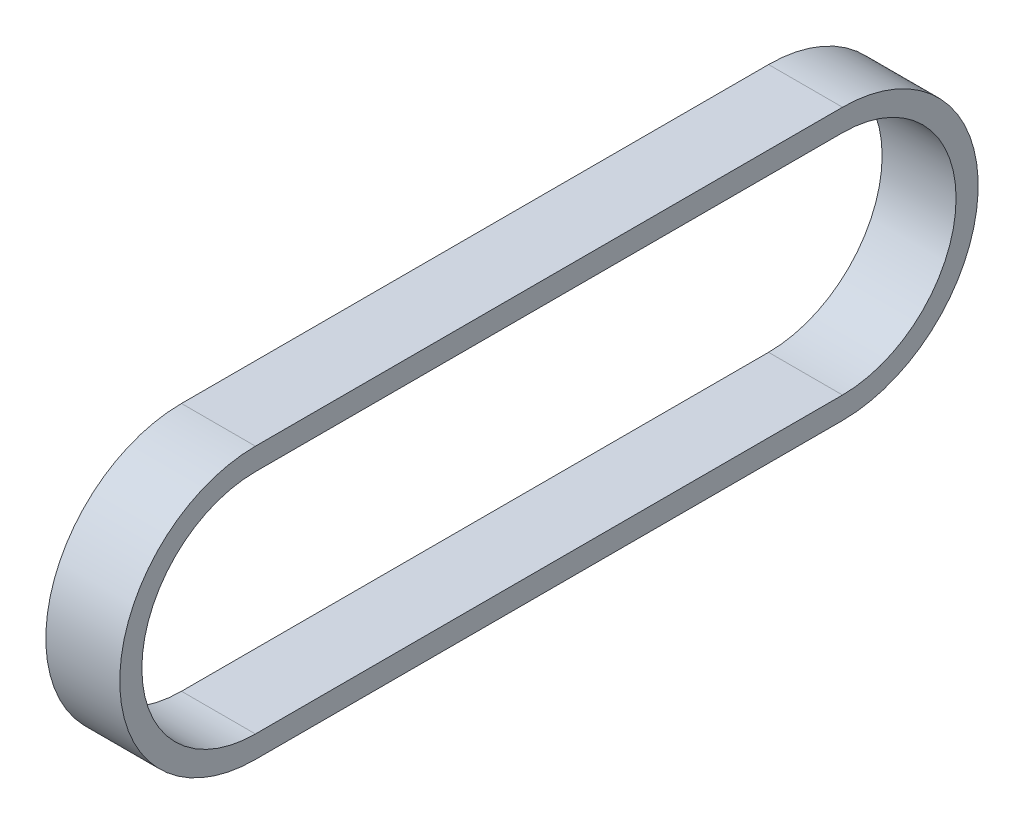
from build123d import *

# Parameters (mm, degrees)
EXTRUDE_THIN1_DEPTH = 8.5


with BuildPart() as part:
    # Sketch1 → Extrude-Thin1 (new body)
    with BuildSketch(Plane(origin=(0, 0, 0), x_dir=(0, 0, -1), z_dir=(1, 0, 0))):
        with BuildLine():
            Line((33.7439, -15.5956), (-33.7439, -15.5956))
            ThreePointArc((-33.7439, -15.5956), (-49.3395, 0), (-33.7439, 15.5956))
            Line((-33.7439, 15.5956), (33.7439, 15.5956))
            ThreePointArc((33.7439, 15.5956), (49.3395, 0), (33.7439, -15.5956))
        make_face()
        with BuildLine():
            Line((33.7439, -13.0556), (-33.7439, -13.0556))
            ThreePointArc((-33.7439, -13.0556), (-46.7995, 0), (-33.7439, 13.0556))
            Line((-33.7439, 13.0556), (33.7439, 13.0556))
            ThreePointArc((33.7439, 13.0556), (46.7995, 0), (33.7439, -13.0556))
        make_face(mode=Mode.SUBTRACT)
    extrude(amount=EXTRUDE_THIN1_DEPTH)


solid = part.part
